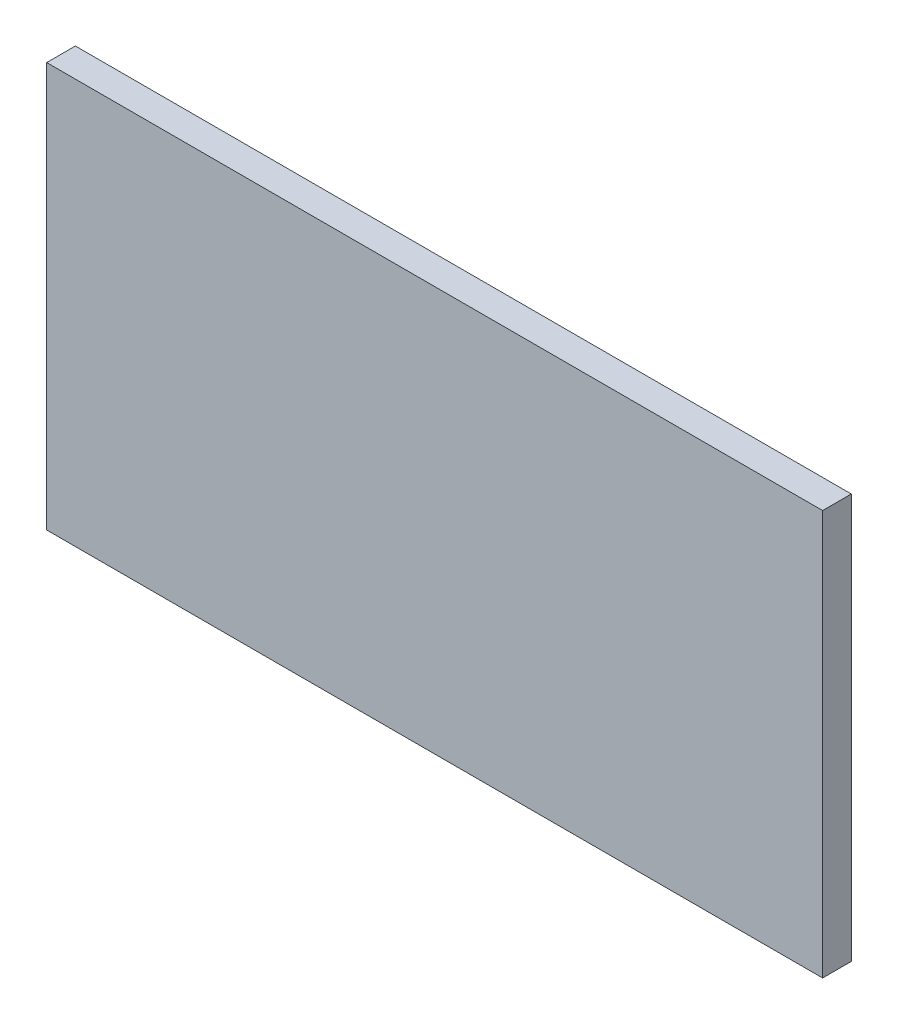
from build123d import *

# Parameters (mm, degrees)
SKETCH_1_W         = 46
SKETCH_1_H         = 24
BLOCKEXTRUDE_DEPTH = 1.7


with BuildPart() as part:
    # 草图1 → BlockExtrude (new body)
    with BuildSketch(Plane.XY):
        with Locations((23, 12)):
            Rectangle(SKETCH_1_W, SKETCH_1_H)
    extrude(amount=BLOCKEXTRUDE_DEPTH)


solid = part.part
